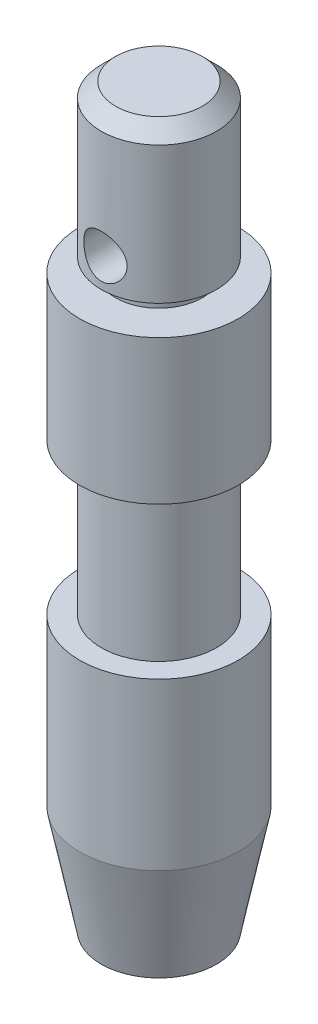
from build123d import *

# Parameters (mm, degrees)
ESQUISSE2_R                  = 5.5
BOSS_EXTRU_2_DEPTH           = 19
CHANFREIN1_SIZE              = 1.5
CHANFREIN1_SIZE2             = 7.5
ESQUISSE8_R                  = 4
BOSS_EXTRU_3_DEPTH           = 10.5
ESQUISSE9_R                  = 5.5
BOSS_EXTRU_4_DEPTH           = 10
ESQUISSE10_R                 = 3
BOSS_EXTRU_5_DEPTH           = 1
ESQUISSE12_R                 = 4
BOSS_EXTRU_6_DEPTH           = 10.5
CHANFREIN2_SIZE              = 1
ENL_V_MAT_EXTRU_1_DEPTH      = 52.58972766
ENL_V_MAT_EXTRU_1_DEPTH_BACK = 52.58972766
ESQUISSE15_R                 = 1.5


with BuildPart() as part:
    # Esquisse2 → Boss.-Extru.2 (new body)
    with BuildSketch(Plane(origin=(0, 0, 0), x_dir=(1, 0, 0), z_dir=(0, 1, 0))):
        with Locations(Location((0, 0, 0), (0, 0, 270))):
            Circle(ESQUISSE2_R)
    extrude(amount=BOSS_EXTRU_2_DEPTH)

    # Chanfrein1
    chanfrein1_edges = [part.edges().sort_by_distance(p)[0] for p in [
        (0, 0, -5.5),
    ]]
    chanfrein1_side = [part.faces().sort_by_distance(p)[0] for p in [
        (0, 0, 0),
    ]]
    chamfer(chanfrein1_edges, length=CHANFREIN1_SIZE, length2=CHANFREIN1_SIZE2, reference=chanfrein1_side[0])

    # Esquisse8 → Boss.-Extru.3 (add)
    with BuildSketch(Plane(origin=(0, 19, 0), x_dir=(1, 0, 0), z_dir=(0, 1, 0))):
        with Locations(Location((0, 0, 0), (0, 0, 90))):
            Circle(ESQUISSE8_R)
    extrude(amount=BOSS_EXTRU_3_DEPTH)

    # Esquisse9 → Boss.-Extru.4 (add)
    with BuildSketch(Plane(origin=(0, 29.5, 0), x_dir=(1, 0, 0), z_dir=(0, 1, 0))):
        with Locations(Location((0, 0, 0), (0, 0, 270))):
            Circle(ESQUISSE9_R)
    extrude(amount=BOSS_EXTRU_4_DEPTH)

    # Esquisse10 → Boss.-Extru.5 (add)
    with BuildSketch(Plane(origin=(0, 39.5, 0), x_dir=(1, 0, 0), z_dir=(0, 1, 0))):
        with Locations(Location((0, 0, 0), (0, 0, 270))):
            Circle(ESQUISSE10_R)
    extrude(amount=BOSS_EXTRU_5_DEPTH)

    # Esquisse12 → Boss.-Extru.6 (add)
    with BuildSketch(Plane(origin=(0, 40.5, 0), x_dir=(1, 0, 0), z_dir=(0, 1, 0))):
        with Locations(Location((0, 0, 0), (0, 0, 90))):
            Circle(ESQUISSE12_R)
    extrude(amount=BOSS_EXTRU_6_DEPTH)

    # Chanfrein2
    chanfrein2_edges = [part.edges().sort_by_distance(p)[0] for p in [
        (0, 51, 4),
    ]]
    chamfer(chanfrein2_edges, length=CHANFREIN2_SIZE)

    # Esquisse15 → Enlèv. mat.-Extru.1 (cut, two sides: drawn at the far end of the back side and taken through both)
    with BuildSketch(Plane.XY.offset(-ENL_V_MAT_EXTRU_1_DEPTH_BACK)):
        with Locations(Location((0, 42.5, 0), (0, 0, 90.000000025))):
            Circle(ESQUISSE15_R)
    extrude(amount=ENL_V_MAT_EXTRU_1_DEPTH + ENL_V_MAT_EXTRU_1_DEPTH_BACK, mode=Mode.SUBTRACT)


solid = part.part
